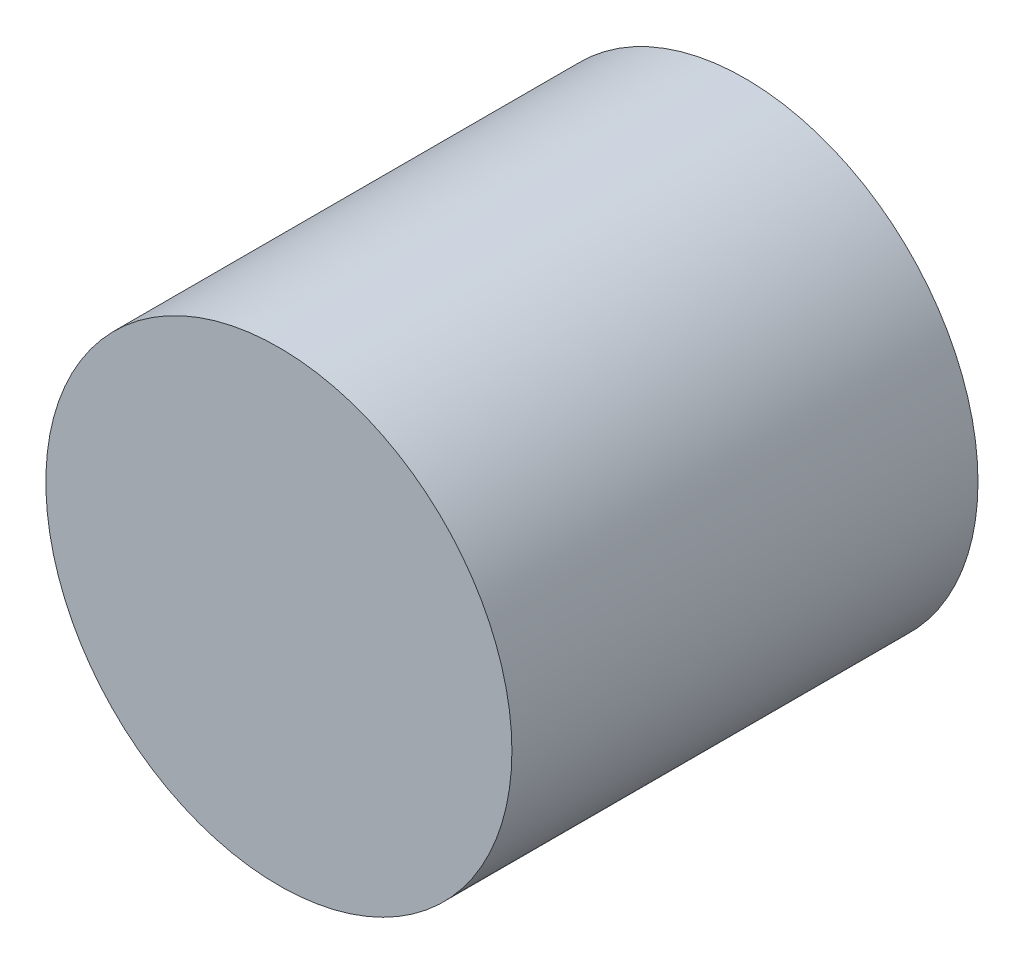
from build123d import *

# Parameters (mm, degrees)
SKETCH1_R           = 3.15
BOSS_EXTRUDE1_DEPTH = 6.3


with BuildPart() as part:
    # Sketch1 → Boss-Extrude1 (new body)
    with BuildSketch(Plane.XY):
        Circle(SKETCH1_R)
    extrude(amount=BOSS_EXTRUDE1_DEPTH)


solid = part.part
